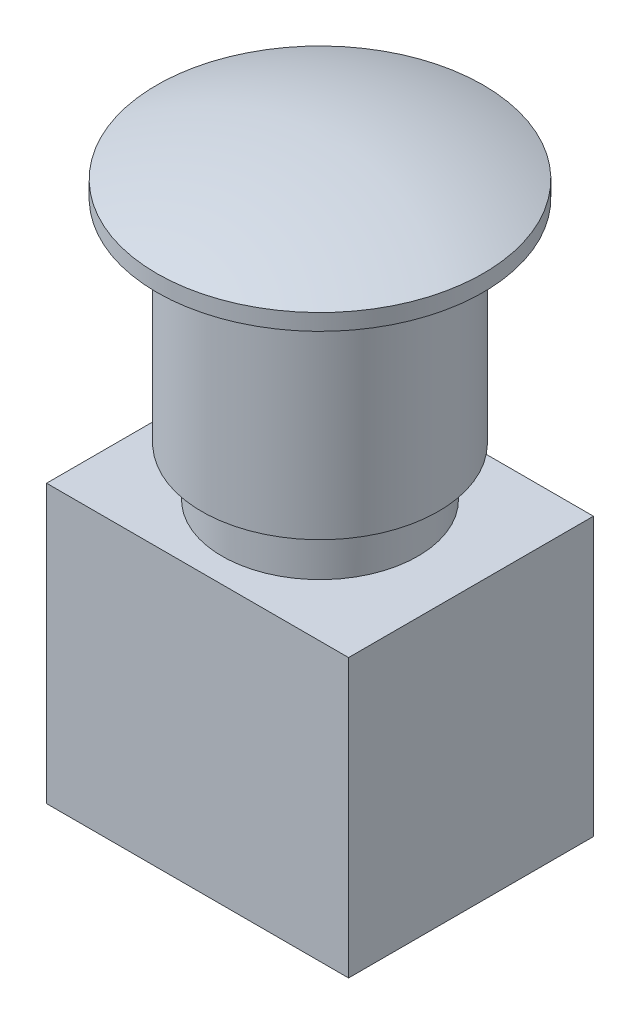
from build123d import *

# Parameters (mm, degrees)
SKETCH_1_W         = 37
SKETCH_1_H         = 30
EXTRUDE_1_DEPTH    = 34
SKETCH_2_R         = 12
EXTRUDE_2_DEPTH    = 6
SKETCH_3_R         = 14.5
EXTRUDE_3_DEPTH    = 26
SKETCH_4_R         = 20
EXTRUDE_4_DEPTH    = 2
DOME_1_FACE_RADIUS = 20
DOME_1_HEIGHT      = 4


with BuildPart() as part:
    # 草图1 → 凸台-拉伸1 (new body)
    with BuildSketch(Plane(origin=(0, 0, 0), x_dir=(1, 0, 0), z_dir=(0, 1, 0))):
        Rectangle(SKETCH_1_W, SKETCH_1_H)
    extrude(amount=EXTRUDE_1_DEPTH)

    # 草图2 → 凸台-拉伸2 (add)
    with BuildSketch(Plane(origin=(0, 34, 0), x_dir=(1, 0, 0), z_dir=(0, 1, 0))):
        with Locations(Location((0, 0, 0), (0, 0, 90))):
            Circle(SKETCH_2_R)
    extrude(amount=EXTRUDE_2_DEPTH)

    # 草图3 → 凸台-拉伸3 (add)
    with BuildSketch(Plane(origin=(0, 40, 0), x_dir=(1, 0, 0), z_dir=(0, 1, 0))):
        with Locations(Location((0, 0, 0), (0, 0, 90))):
            Circle(SKETCH_3_R)
    extrude(amount=EXTRUDE_3_DEPTH)

    # 草图4 → 凸台-拉伸4 (add)
    with BuildSketch(Plane(origin=(0, 66, 0), x_dir=(1, 0, 0), z_dir=(0, 1, 0))):
        with Locations(Location((0, 0, 0), (0, 0, 270))):
            Circle(SKETCH_4_R)
    extrude(amount=EXTRUDE_4_DEPTH)

    # 圆顶1: a dome of height H over a round flat face of radius A is a cap of a sphere of radius (A * A + H * H) / (2 * H)
    dome_1_r = (DOME_1_FACE_RADIUS * DOME_1_FACE_RADIUS + DOME_1_HEIGHT * DOME_1_HEIGHT) / (2 * DOME_1_HEIGHT)
    dome_1_base = Plane((0, 68, 0), z_dir=(0, 1, 0))
    with Locations(dome_1_base.offset(DOME_1_HEIGHT - dome_1_r)):
        dome_1_ball = Sphere(dome_1_r, mode=Mode.PRIVATE)
    add(split(dome_1_ball, bisect_by=dome_1_base, keep=Keep.TOP, mode=Mode.PRIVATE))


solid = part.part
